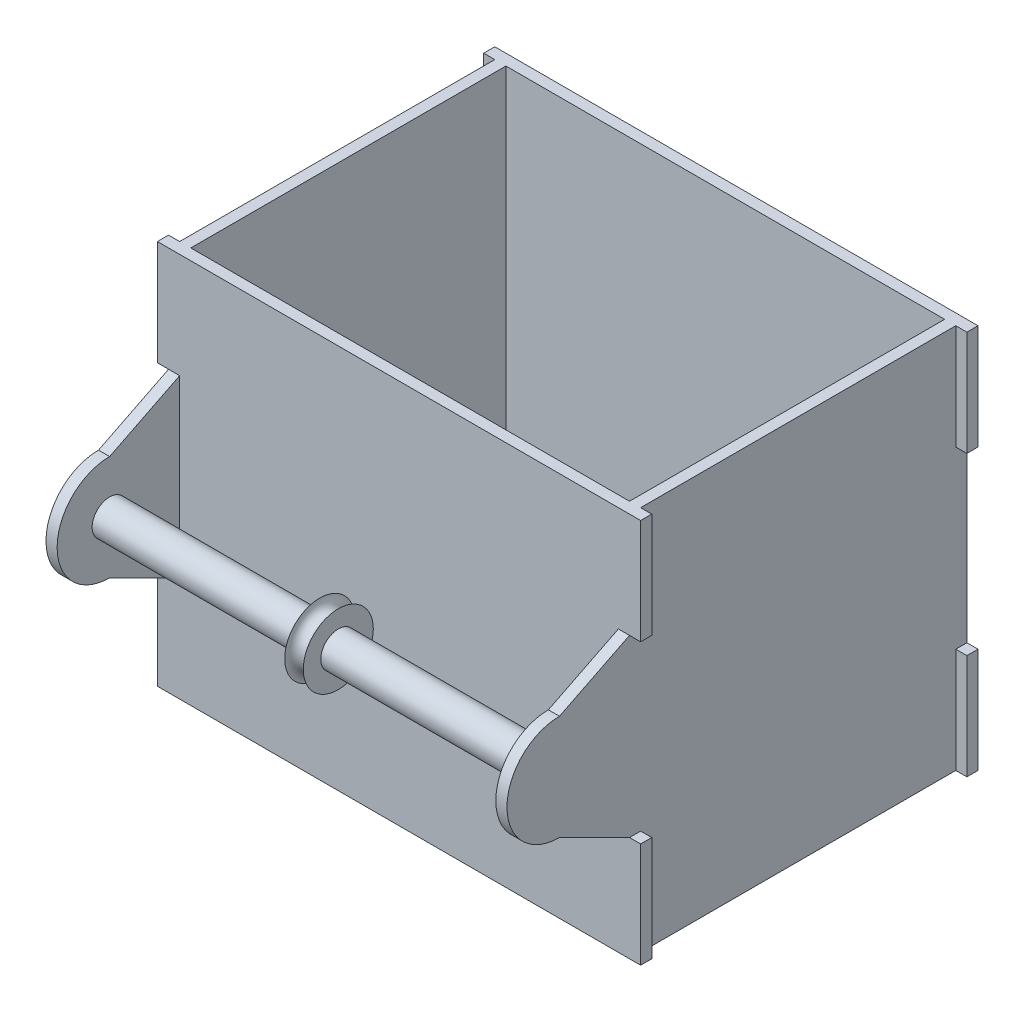
from build123d import *

# Parameters (mm, degrees)
BOSS_EXTRUDE1_DEPTH = 3.175
SKETCH3_W           = 3.175
SKETCH3_H           = 110
BOSS_EXTRUDE2_DEPTH = 90
BOSS_EXTRUDE3_DEPTH = 3.175
BOSS_EXTRUDE4_DEPTH = 3.175
BOSS_EXTRUDE5_START = -3.175
BOSS_EXTRUDE5_DEPTH = 3.175
SKETCH7_R           = 5
BOSS_EXTRUDE6_DEPTH = 128.475
SKETCH8_R           = 10
BOSS_EXTRUDE7_DEPTH = 5.3
SKETCH10_R          = 2.65


with BuildPart() as part:
    # Sketch2 → Boss-Extrude1 (new body)
    with BuildSketch(Plane.XY):
        Polygon((0, 50), (-3.175, 50), (-3.175, 80), (134.825, 80), (134.825, 50), (131.65, 50), (131.65, 0), (134.825, 0), (134.825, -30), (-3.175, -30), (-3.175, 0), (0, 0), align=None)
    extrude(amount=BOSS_EXTRUDE1_DEPTH)

    # Sketch3 → Boss-Extrude2 (add)
    with BuildSketch(Plane.XY.offset(3.175)):
        with Locations((1.5875, 25)):
            Rectangle(SKETCH3_W, SKETCH3_H)
        with Locations((130.0625, 25)):
            Rectangle(SKETCH3_W, SKETCH3_H)
    extrude(amount=BOSS_EXTRUDE2_DEPTH)

    # Sketch4 → Boss-Extrude3 (add)
    with BuildSketch(Plane.XY.offset(93.175)):
        Polygon((131.65, 50), (134.825, 50), (134.825, 80), (-3.175, 80), (-3.175, 50), (-1.5875, 50), (0, 50), (0, 0), (-3.175, 0), (-3.175, -30), (134.825, -30), (134.825, 0), (131.65, 0), align=None)
    extrude(amount=BOSS_EXTRUDE3_DEPTH)

    # Sketch5 → Boss-Extrude4 (add)
    with BuildSketch(Plane.ZY):
        with BuildLine():
            Line((96.35, 50), (96.35, 0))
            Line((96.35, 0), (116.35, 10))
            ThreePointArc((116.35, 10), (131.35, 25), (116.35, 40))
            Line((116.35, 40), (96.35, 50))
        make_face()
    extrude(amount=-BOSS_EXTRUDE4_DEPTH)

    # Sketch6 → Boss-Extrude5 (add)
    with BuildSketch(Plane(origin=(131.65, 0, 0), x_dir=(0, 0, -1), z_dir=(1, 0, 0)).offset(BOSS_EXTRUDE5_START)):
        with BuildLine():
            Line((-96.35, 0), (-116.35, 10))
            ThreePointArc((-116.35, 10), (-131.35, 25), (-116.35, 40))
            Line((-116.35, 40), (-96.35, 50))
            Line((-96.35, 50), (-96.35, 0))
        make_face()
    extrude(amount=BOSS_EXTRUDE5_DEPTH)

    # Sketch7 → Boss-Extrude6 (add)
    with BuildSketch(Plane(origin=(131.65, 0, 0), x_dir=(0, 0, -1), z_dir=(1, 0, 0))):
        with Locations((-116.35, 25)):
            Circle(SKETCH7_R)
    extrude(amount=-BOSS_EXTRUDE6_DEPTH)

    # Sketch8 → Boss-Extrude7 (add)
    with BuildSketch(Plane.ZY.offset(-68.475)):
        with Locations((116.35, 25)):
            Circle(SKETCH8_R)
    extrude(amount=BOSS_EXTRUDE7_DEPTH)

    # Sketch10 → Cut-Revolve1 (revolve, cut)
    with BuildSketch(Plane(origin=(0, 25, 0), x_dir=(1, 0, 0), z_dir=(0, 1, 0)), mode=Mode.PRIVATE) as cut_revolve1_sk:
        with Locations((65.825, -106.35)):
            Circle(SKETCH10_R)
    revolve(cut_revolve1_sk.sketch.rotate(Axis((63.175, 25, 116.35), (-1, 0, 0)), 180), axis=Axis((63.175, 25, 116.35), (-1, 0, 0)), mode=Mode.SUBTRACT)


solid = part.part
